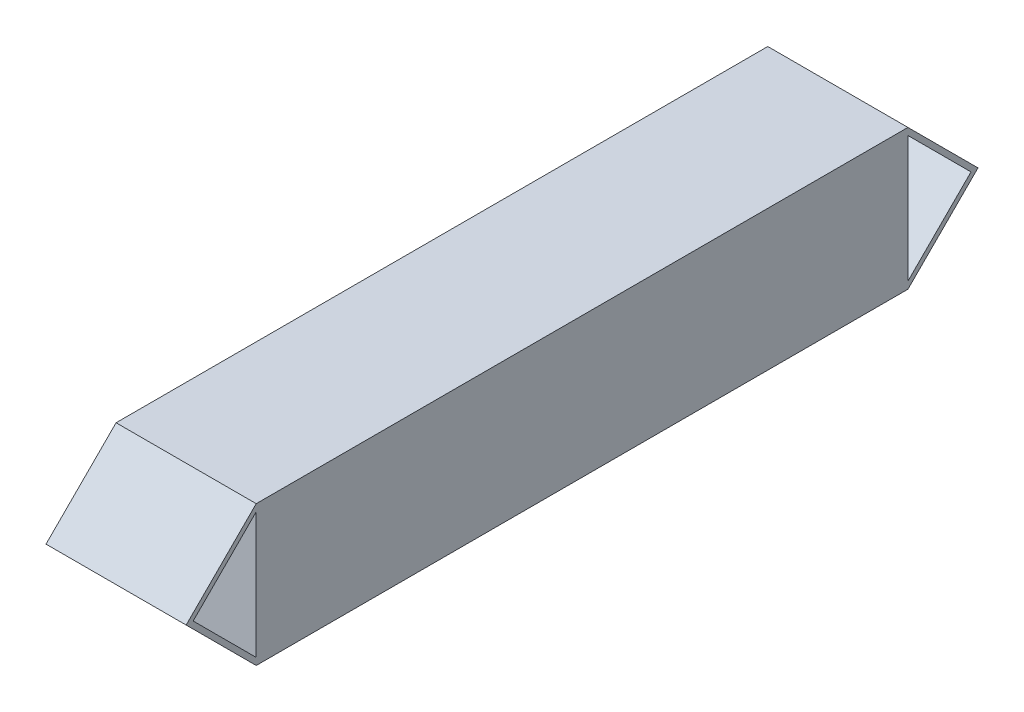
from build123d import *

# Parameters (mm, degrees)
CROQUIS1_W              = 40
CROQUIS1_H              = 40
SALIENTE_EXTRUIR1_DEPTH = 186
SALIENTE_EXTRUIR2_DEPTH = 40


with BuildPart() as part:
    # Croquis1 → Saliente-Extruir1 (new body)
    with BuildSketch(Plane.XY):
        Rectangle(CROQUIS1_W, CROQUIS1_H)
    extrude(amount=SALIENTE_EXTRUIR1_DEPTH)

    # Croquis4 → Saliente-Extruir2 (add)
    with BuildSketch(Plane(origin=(20, 0, 0), x_dir=(0, 0, -1), z_dir=(1, 0, 0))):
        Polygon((0, -20), (20, 0), (18, 0), (0, -18), align=None)
        Polygon((20, 0), (0, 20), (0, 18), (18, 0), align=None)
        Polygon((-186, 18), (-186, 20), (-206, 0), (-204, 0), align=None)
        Polygon((-204, 0), (-206, 0), (-186, -20), (-186, -18), align=None)
    extrude(amount=-SALIENTE_EXTRUIR2_DEPTH)


solid = part.part
